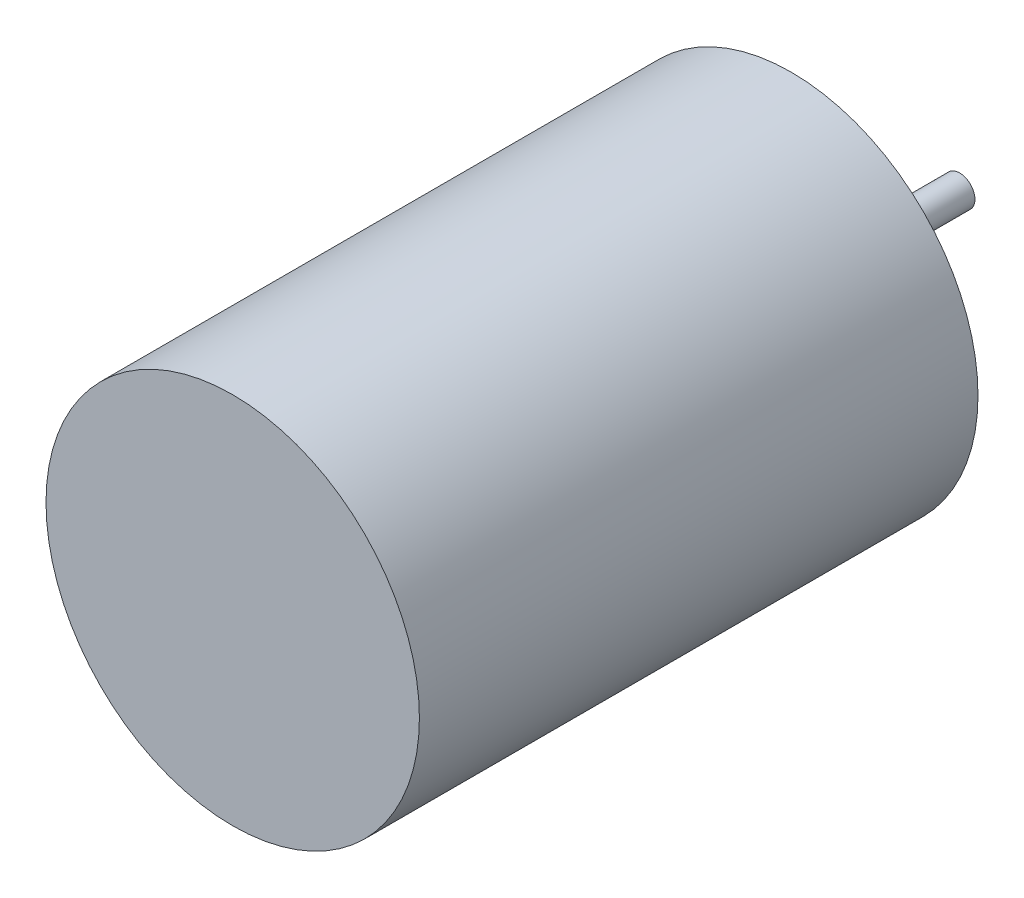
from build123d import *

# Parameters (mm, degrees)
SKETCH_1_R          = 12.2
EXTRUDE_4_DEPTH     = 36.5
SKETCH_10_R         = 1
EXTRUDE_7_DEPTH     = 11
SKETCH_11_R         = 3.225
EXTRUDE_8_DEPTH     = 0.5
SKETCH_13_R         = 1.5
CUT_EXTRUDE_2_DEPTH = 3


with BuildPart() as part:
    # 草图1 → 凸台-拉伸4 (new body)
    with BuildSketch(Plane.XY):
        Circle(SKETCH_1_R)
    extrude(amount=EXTRUDE_4_DEPTH)

    # 草图10 → 凸台-拉伸7 (add)
    with BuildSketch(Plane(origin=(0, 0, 0), x_dir=(-1, 0, 0), z_dir=(0, 0, -1))):
        with Locations(Location((0, 0, 0), (0, 0, 180))):
            Circle(SKETCH_10_R)
    extrude(amount=EXTRUDE_7_DEPTH)

    # 草图11 → 凸台-拉伸8 (add)
    with BuildSketch(Plane(origin=(0, 0, 0), x_dir=(-1, 0, 0), z_dir=(0, 0, -1))):
        with Locations(Location((0, 0, 0), (0, 0, 180))):
            Circle(SKETCH_11_R)
    extrude(amount=EXTRUDE_8_DEPTH)

    # 草图13 → 切除-拉伸2 (cut)
    with BuildSketch(Plane(origin=(0, 0, 0), x_dir=(-1, 0, 0), z_dir=(0, 0, -1))):
        with Locations((0, 8.504557186)):
            Circle(SKETCH_13_R)
        with Locations((0, -8.512012438)):
            Circle(SKETCH_13_R)
    extrude(amount=-CUT_EXTRUDE_2_DEPTH, mode=Mode.SUBTRACT)


solid = part.part
